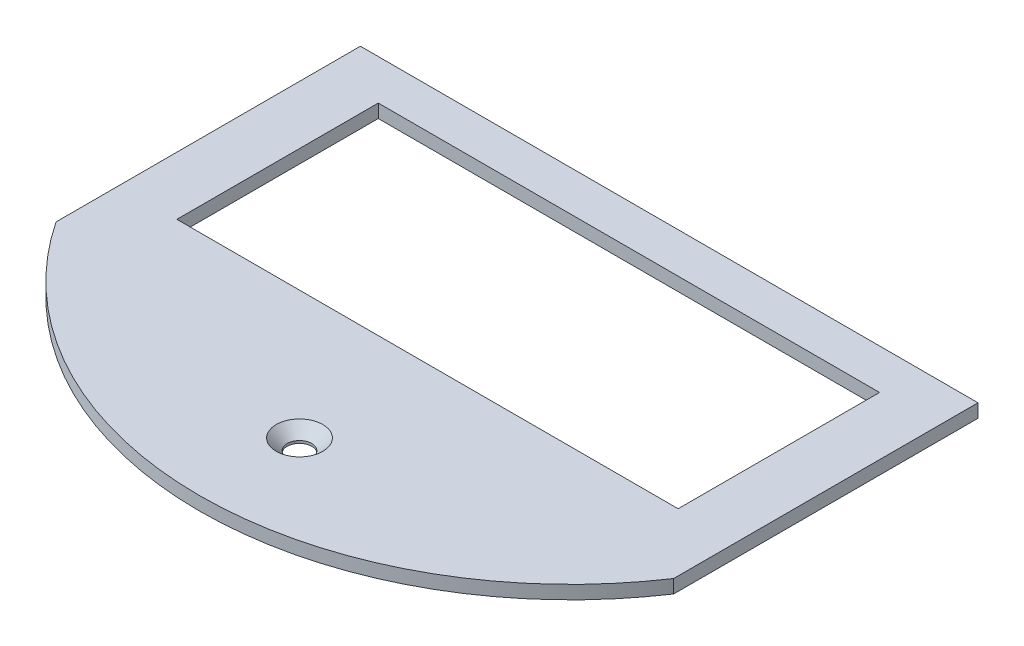
from build123d import *

# Parameters (mm, degrees)
EXTRUDE_1_DEPTH     = 3
SKETCH_2_W          = 112
SKETCH_2_H          = 45
CUT_EXTRUDE_1_DEPTH = 174.386325559


with BuildPart() as part:
    # Эскиз1 → Бобышка-Вытянуть1 (new body)
    with BuildSketch(Plane(origin=(0, 0, 0), x_dir=(1, 0, 0), z_dir=(0, 1, 0))):
        with BuildLine():
            Line((0, 0), (138, 0))
            Line((138, 0), (138, -68))
            ThreePointArc((138, -68), (69, -104.927679336), (0, -68))
            Line((0, -68), (0, 0))
        make_face()
    extrude(amount=EXTRUDE_1_DEPTH)

    # Эскиз2 → Вырез-Вытянуть1 (cut, through all)
    with BuildSketch(Plane(origin=(0, 3, 0), x_dir=(1, 0, 0), z_dir=(0, 1, 0))):
        with Locations((69, -31.5)):
            Rectangle(SKETCH_2_W, SKETCH_2_H)
    extrude(amount=-CUT_EXTRUDE_1_DEPTH, mode=Mode.SUBTRACT)

    # Эскиз3 → Зенковка для  винта с плоской головкой M51 (revolve, cut)
    with BuildSketch(Plane(origin=(69, 3, 82.6), x_dir=(0, 0, 1), z_dir=(1, 0, 0))):
        Polygon((0, 0), (0, 3), (2.75, 3), (2.75, 2.45), (5.2, 0), align=None)
    revolve(axis=Axis((69, 9.35, 82.6), (0, -1, 0)), mode=Mode.SUBTRACT)


solid = part.part
